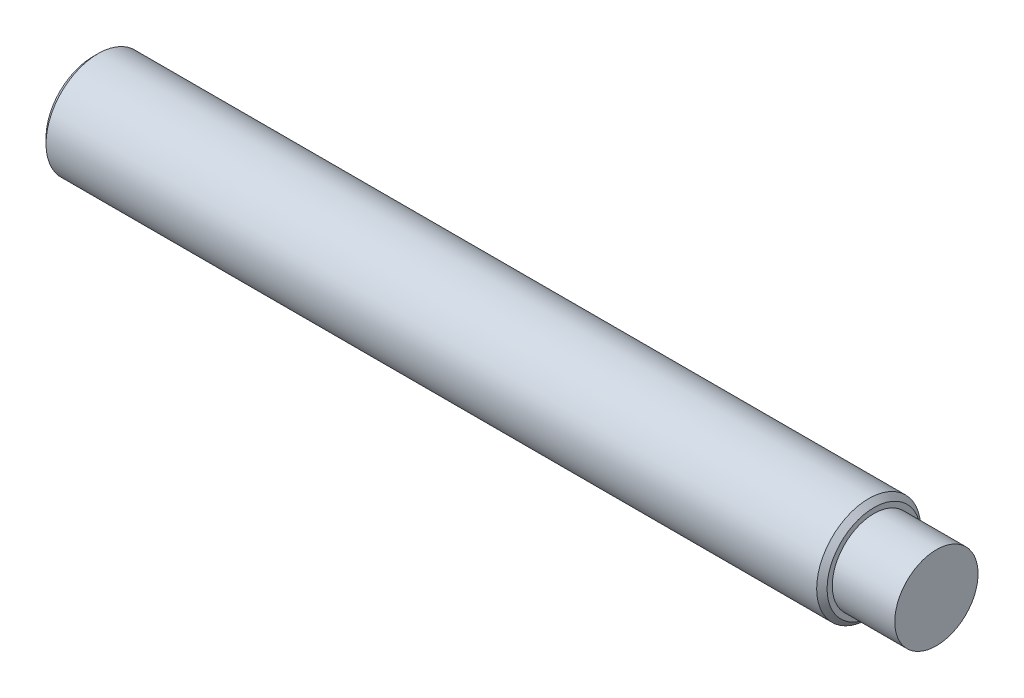
from build123d import *

# Parameters (mm, degrees)
CHAMFER1_SIZE      = 0.5
SKETCH6_R          = 3
CUT_EXTRUDE1_DEPTH = 10


with BuildPart() as part:
    # Sketch1 → Revolve1 (revolve)
    with BuildSketch(Plane.XY, mode=Mode.PRIVATE) as revolve1_sk:
        Polygon((0, 0), (0, 5), (75, 5), (75, 4), (81, 4), (81, 0), align=None)
    revolve(revolve1_sk.sketch.rotate(Axis((-21.625122332, 0, 0), (1, 0, 0)), 90), axis=Axis((-21.625122332, 0, 0), (1, 0, 0)))

    # Chamfer1
    chamfer1_edges = [part.edges().sort_by_distance(p)[0] for p in [
        (75, 0, -5),
        (0, 0, -5),
    ]]
    chamfer(chamfer1_edges, length=CHAMFER1_SIZE)

    # Sketch6 → Cut-Extrude1 (cut)
    with BuildSketch(Plane.ZY):
        Circle(SKETCH6_R)
    extrude(amount=-CUT_EXTRUDE1_DEPTH, mode=Mode.SUBTRACT)


solid = part.part
